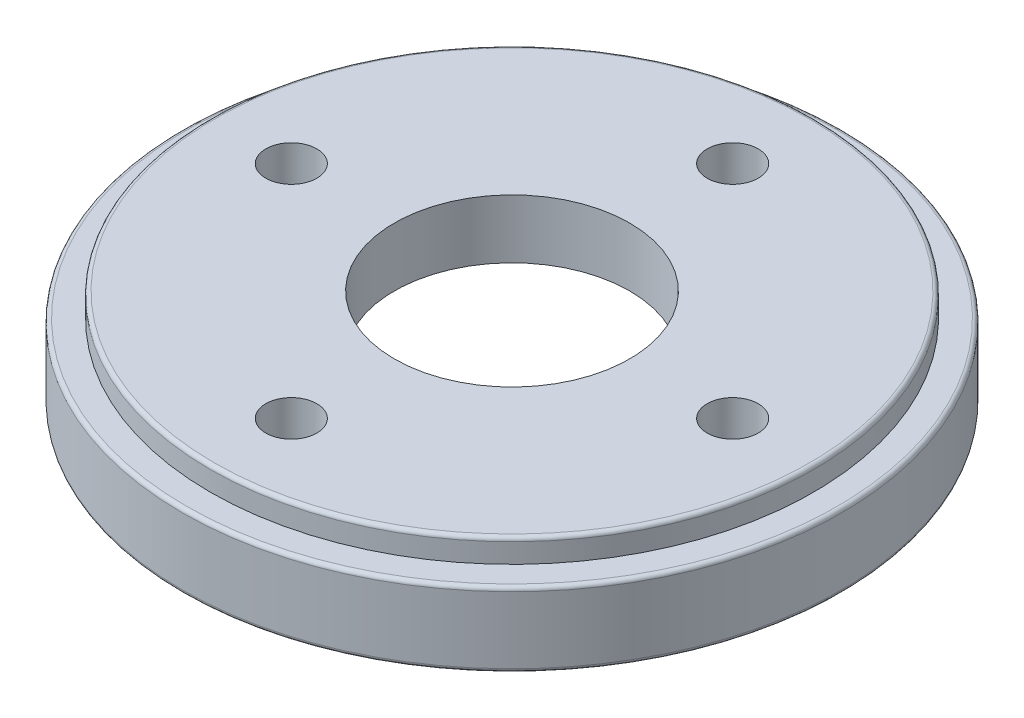
from build123d import *

# Parameters (mm, degrees)
SKETCH_1_R          = 16.8
SKETCH_1_R_2        = 1.3
SKETCH_1_R_3        = 6
EXTRUDE_1_DEPTH     = 5
CUT_EXTRUDE_START   = -1.2
SKETCH_2_R          = 16.8
SKETCH_2_R_2        = 15.375
CUT_EXTRUDE_1_DEPTH = 1.2
FILLET_1_R          = 0.2
SKETCH_3_R          = 14.8
CUT_EXTRUDE_2_DEPTH = 2
FILLET_2_R          = 0.2


with BuildPart() as part:
    # 草图1 → 凸台-拉伸1 (new body)
    with BuildSketch(Plane(origin=(0, 0, 0), x_dir=(1, 0, 0), z_dir=(0, 1, 0))):
        with Locations(Location((0, 0, 0), (0, 0, 270))):
            Circle(SKETCH_1_R)
        with Locations(Location((0, 11.25, 0), (0, 0, 270))):
            Circle(SKETCH_1_R_2, mode=Mode.SUBTRACT)
        with Locations(Location((11.25, 0, 0), (0, 0, 270))):
            Circle(SKETCH_1_R_2, mode=Mode.SUBTRACT)
        with Locations(Location((0, -11.25, 0), (0, 0, 270))):
            Circle(SKETCH_1_R_2, mode=Mode.SUBTRACT)
        with Locations(Location((-11.25, 0, 0), (0, 0, 270))):
            Circle(SKETCH_1_R_2, mode=Mode.SUBTRACT)
        with Locations(Location((0, 0, 0), (0, 0, 270))):
            Circle(SKETCH_1_R_3, mode=Mode.SUBTRACT)
    extrude(amount=EXTRUDE_1_DEPTH)

    # 草图2 → 切除-拉伸1 (cut)
    with BuildSketch(Plane(origin=(0, 5, 0), x_dir=(1, 0, 0), z_dir=(0, 1, 0)).offset(CUT_EXTRUDE_START)):
        with Locations(Location((0, 0, 0), (0, 0, 270))):
            Circle(SKETCH_2_R)
        with Locations(Location((0, 0, 0), (0, 0, 270))):
            Circle(SKETCH_2_R_2, mode=Mode.SUBTRACT)
    extrude(amount=CUT_EXTRUDE_1_DEPTH, mode=Mode.SUBTRACT)

    # 圆角1
    fillet_1_edges = [part.edges().sort_by_distance(p)[0] for p in [
        (0, 3.8, -16.8),
        (0, 5, -15.375),
    ]]
    fillet(fillet_1_edges, radius=FILLET_1_R)

    # 草图3 → 切除-拉伸2 (cut)
    with BuildSketch(Plane.XZ):
        with Locations(Location((0, 0, 0), (0, 0, 270))):
            Circle(SKETCH_3_R)
    extrude(amount=-CUT_EXTRUDE_2_DEPTH, mode=Mode.SUBTRACT)

    # 圆角2
    fillet_2_edges = [part.edges().sort_by_distance(p)[0] for p in [
        (0, 0, -16.8),
    ]]
    fillet(fillet_2_edges, radius=FILLET_2_R)


solid = part.part
